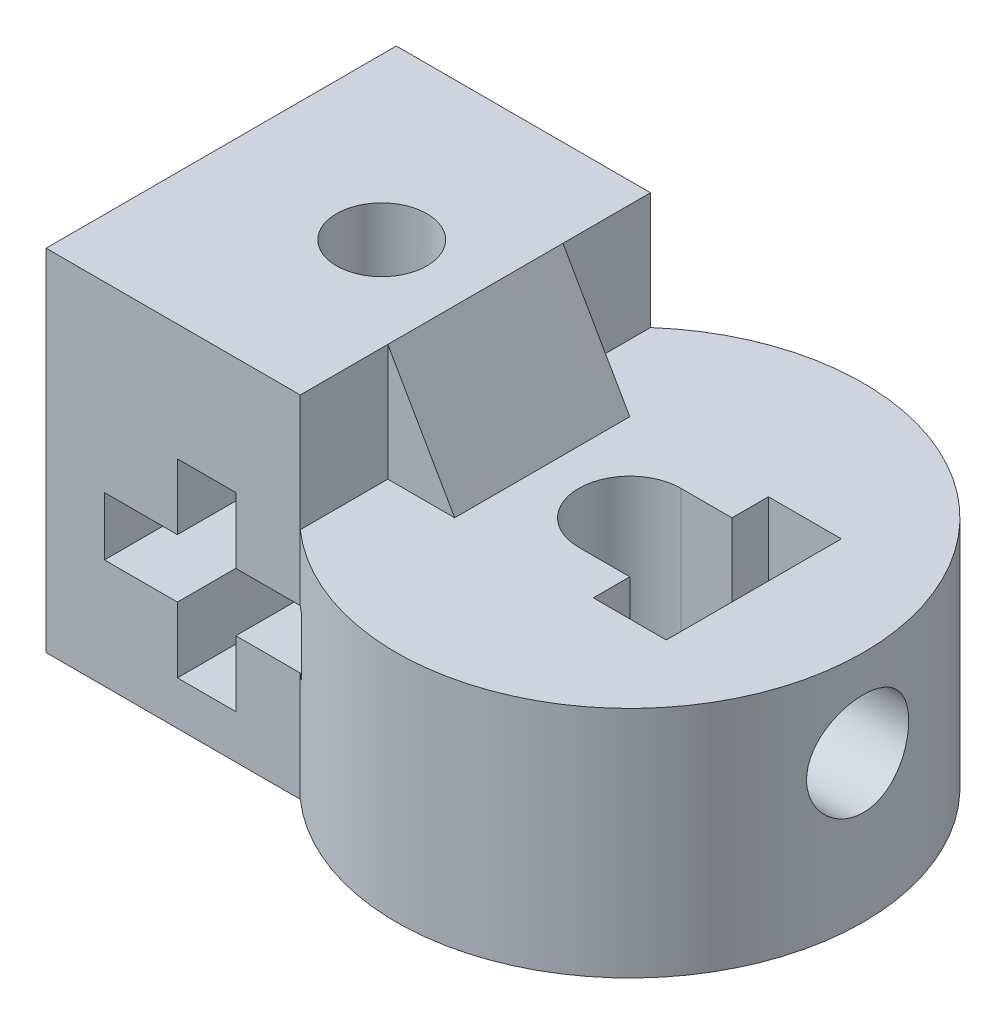
from build123d import *

# Parameters (mm, degrees)
EXTRUDE_1_DEPTH          = 8
SKETCH_4_R               = 7
CUT_EXTRUDE_3_DEPTH      = 2
SKETCH_7_W               = 8.708497378
SKETCH_7_H               = 12
EXTRUDE_2_DEPTH          = 4
SKETCH_2_R               = 1.75
CUT_EXTRUDE_1_DEPTH      = 24.260750203
CUT_EXTRUDE_2_DEPTH      = 33.695565574
CUT_EXTRUDE_2_DEPTH_BACK = 33.695565574
CUT_EXTRUDE_4_REACH      = 22.1
SKETCH_5_R               = 1.55
RIB_1_REACH              = 22.1
SKETCH_8_WALL_W          = 46.80938155
SKETCH_8_WALL_H          = 6


with BuildPart() as part:
    # 草图1 → 凸台-拉伸1 (new body)
    with BuildSketch(Plane(origin=(0, 0, 0), x_dir=(1, 0, 0), z_dir=(0, 1, 0))):
        with BuildLine():
            Line((-14, 6), (-5.291502622, 6))
            ThreePointArc((-5.291502622, 6), (8, 0), (-5.291502622, -6))
            Line((-5.291502622, -6), (-14, -6))
            Line((-14, -6), (-14, 6))
        make_face()
        with BuildLine():
            Line((1.75, 3), (1.75, 1.75))
            Line((1.75, 1.75), (0, 1.75))
            ThreePointArc((0, 1.75), (-1.75, 0), (0, -1.75))
            Line((0, -1.75), (1.75, -1.75))
            Line((1.75, -1.75), (1.75, -3))
            Line((1.75, -3), (4.25, -3))
            Line((4.25, -3), (4.25, 3))
            Line((4.25, 3), (1.75, 3))
        make_face(mode=Mode.SUBTRACT)
    extrude(amount=EXTRUDE_1_DEPTH)

    # 草图4 → 切除-拉伸3 (cut)
    with BuildSketch(Plane.XZ):
        with Locations(Location((0, 0, 0), (0, 0, 270))):
            Circle(SKETCH_4_R)
    extrude(amount=-CUT_EXTRUDE_3_DEPTH, mode=Mode.SUBTRACT)

    # 草图7 → 凸台-拉伸2 (add)
    with BuildSketch(Plane(origin=(0, 8, 0), x_dir=(1, 0, 0), z_dir=(0, 1, 0))):
        with Locations((-9.645751311, 0)):
            Rectangle(SKETCH_7_W, SKETCH_7_H)
    extrude(amount=EXTRUDE_2_DEPTH)

    # 草图2 → 切除-拉伸1 (cut, through all)
    with BuildSketch(Plane.ZY.offset(-4.25)):
        with Locations((0, 5)):
            Circle(SKETCH_2_R)
    extrude(amount=-CUT_EXTRUDE_1_DEPTH, mode=Mode.SUBTRACT)

    # 草图3 → 切除-拉伸2 (cut, two sides: drawn at the far end of the back side and taken through both)
    with BuildSketch(Plane(origin=(-19, 0, 6), x_dir=(-1, 0, 0), z_dir=(0, 0, -1)).offset(-CUT_EXTRUDE_2_DEPTH_BACK)):
        Polygon((-11.5, 1.5), (-9.5, 1.5), (-9.5, 3.75), (-7, 3.75), (-7, 5.75), (-9.5, 5.75), (-9.5, 8), (-11.5, 8), (-11.5, 5.75), (-14, 5.75), (-14, 3.75), (-11.5, 3.75), align=None)
    extrude(amount=CUT_EXTRUDE_2_DEPTH + CUT_EXTRUDE_2_DEPTH_BACK, mode=Mode.SUBTRACT)

    # 草图5 → 切除-拉伸4 (cut, up to next)
    with BuildSketch(Plane(origin=(0, 12, 0), x_dir=(1, 0, 0), z_dir=(0, 1, 0)), mode=Mode.PRIVATE) as cut_extrude_4_sk1:
        with Locations(Location((-8.5, 0, 0), (0, 0, 270))):
            Circle(SKETCH_5_R)
    cut_extrude_4_tool1 = extrude(cut_extrude_4_sk1.sketch, amount=-CUT_EXTRUDE_4_REACH, mode=Mode.PRIVATE) & part.part
    add(cut_extrude_4_tool1.solids().sort_by_distance((-8.5, 12, 0))[0], mode=Mode.SUBTRACT)

    # 草图8 wall → 筋1 (add, up to next)
    with BuildSketch(Plane(origin=(-4.145751311, 10, 0), x_dir=(0.497085200913, -0.867701736216, 0), z_dir=(0.867701736216, 0.497085200913, 0)), mode=Mode.PRIVATE) as rib_1_sk1:
        Rectangle(SKETCH_8_WALL_W, SKETCH_8_WALL_H)
    rib_1_tool1 = extrude(rib_1_sk1.sketch, amount=-RIB_1_REACH, mode=Mode.PRIVATE) - part.part
    add(rib_1_tool1.solids().sort_by_distance((-4.145751311, 10, 0))[0])


solid = part.part
